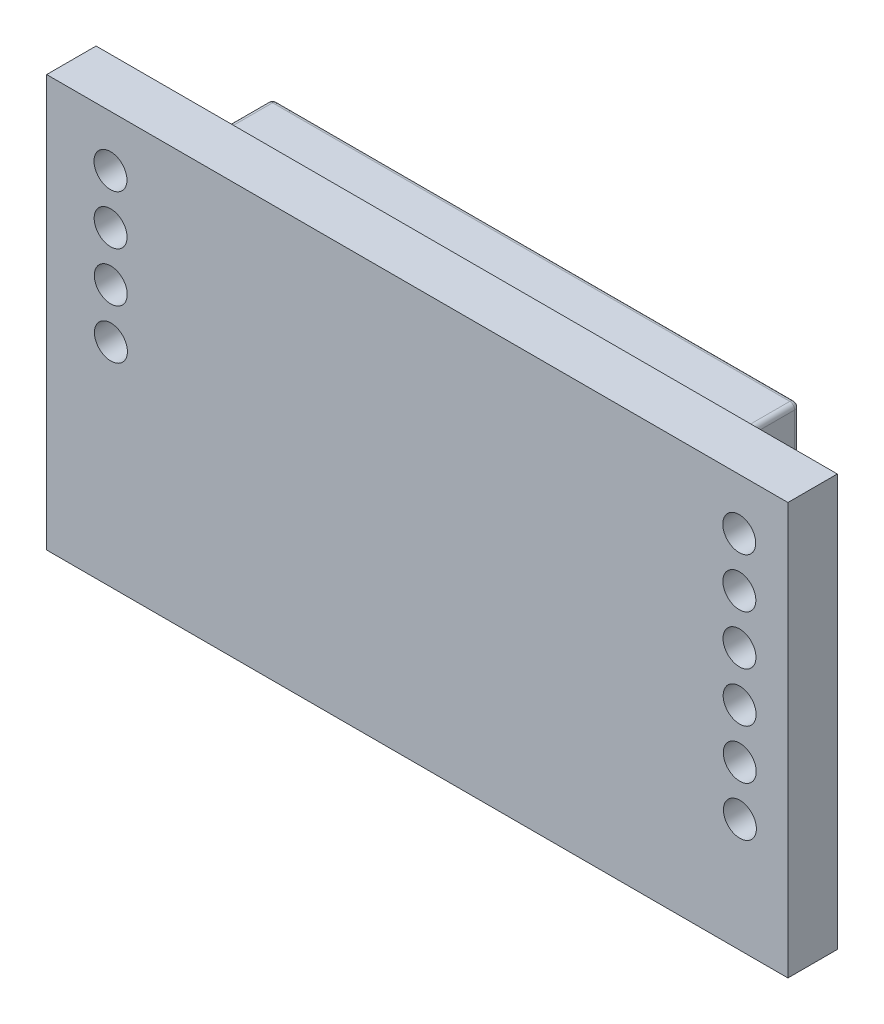
from build123d import *

# Parameters (mm, degrees)
SKETCH1_W               = 45
SKETCH1_H               = 25
BOSS_EXTRUDE1_DEPTH     = 3
SKETCH2_W               = 32
SKETCH2_H               = 22
BOSS_EXTRUDE2_DEPTH     = 3.5
FILLET2_R               = 0.3
FILLET3_R               = 0.3
FILLET4_R               = 0.3
FILLET5_R               = 0.3
CUT_EXTRUDE4_DEPTH      = 52.596996037
CUT_EXTRUDE4_DEPTH_BACK = 7.5
SKETCH3_R               = 1


with BuildPart() as part:
    # Sketch1 → Boss-Extrude1 (new body)
    with BuildSketch(Plane.XY):
        with Locations((-22.5, 12.5)):
            Rectangle(SKETCH1_W, SKETCH1_H)
    extrude(amount=BOSS_EXTRUDE1_DEPTH)

    # Sketch2 → Boss-Extrude2 (add)
    with BuildSketch(Plane.XY):
        with Locations((-21.788087931, 13.170864642)):
            Rectangle(SKETCH2_W, SKETCH2_H)
    extrude(amount=-BOSS_EXTRUDE2_DEPTH)

    # Fillet2
    fillet2_edges = [part.edges().sort_by_distance(p)[0] for p in [
        (-5.788087931, 2.170864642, -1.75),
    ]]
    fillet(fillet2_edges, radius=FILLET2_R)

    # Fillet3
    fillet3_edges = [part.edges().sort_by_distance(p)[0] for p in [
        (-5.788087931, 13.320864642, -3.5),
        (-21.938087931, 2.170864642, -3.5),
        (-5.875955896, 2.258732607, -3.5),
    ]]
    fillet(fillet3_edges, radius=FILLET3_R)

    # Fillet4
    fillet4_edges = [part.edges().sort_by_distance(p)[0] for p in [
        (-37.788087931, 13.320864642, -3.5),
        (-37.788087931, 2.170864642, -1.6),
        (-37.788087931, 2.258732607, -3.412132034),
    ]]
    fillet(fillet4_edges, radius=FILLET4_R)

    # Fillet5
    fillet5_edges = [part.edges().sort_by_distance(p)[0] for p in [
        (-21.788087931, 24.170864642, -3.5),
        (-5.788087931, 24.170864642, -1.6),
        (-5.875955896, 24.170864642, -3.412132034),
        (-37.788087931, 24.170864642, -1.6),
        (-37.700219965, 24.170864642, -3.412132034),
    ]]
    fillet(fillet5_edges, radius=FILLET5_R)

    # Sketch3 → Cut-Extrude4 (cut, two sides: drawn at the far end of the back side and taken through both)
    with BuildSketch(Plane(origin=(0, 0, 0), x_dir=(-1, 0, 0), z_dir=(0, 0, -1)).offset(-CUT_EXTRUDE4_DEPTH_BACK)):
        with Locations(Location((41.126309662, 21.886420327, 0), (0, 0, 180))):
            Circle(SKETCH3_R)
        with Locations(Location((2.955391169, 21.886420327, 0), (0, 0, 180))):
            Circle(SKETCH3_R)
        with Locations(Location((41.117621493, 18.886432907, 0), (0, 0, 180))):
            Circle(SKETCH3_R)
        with Locations(Location((41.108933323, 15.886445488, 0), (0, 0, 180))):
            Circle(SKETCH3_R)
        with Locations(Location((41.100245154, 12.886458069, 0), (0, 0, 180))):
            Circle(SKETCH3_R)
        with Locations(Location((2.947370185, 18.886431049, 0), (0, 0, 180))):
            Circle(SKETCH3_R)
        with Locations(Location((2.939349201, 15.886441772, 0), (0, 0, 180))):
            Circle(SKETCH3_R)
        with Locations(Location((2.931328218, 12.886452495, 0), (0, 0, 180))):
            Circle(SKETCH3_R)
        with Locations(Location((2.923307234, 9.886463217, 0), (0, 0, 180))):
            Circle(SKETCH3_R)
        with Locations(Location((2.91528625, 6.88647394, 0), (0, 0, 180))):
            Circle(SKETCH3_R)
    extrude(amount=CUT_EXTRUDE4_DEPTH + CUT_EXTRUDE4_DEPTH_BACK, mode=Mode.SUBTRACT)


solid = part.part
